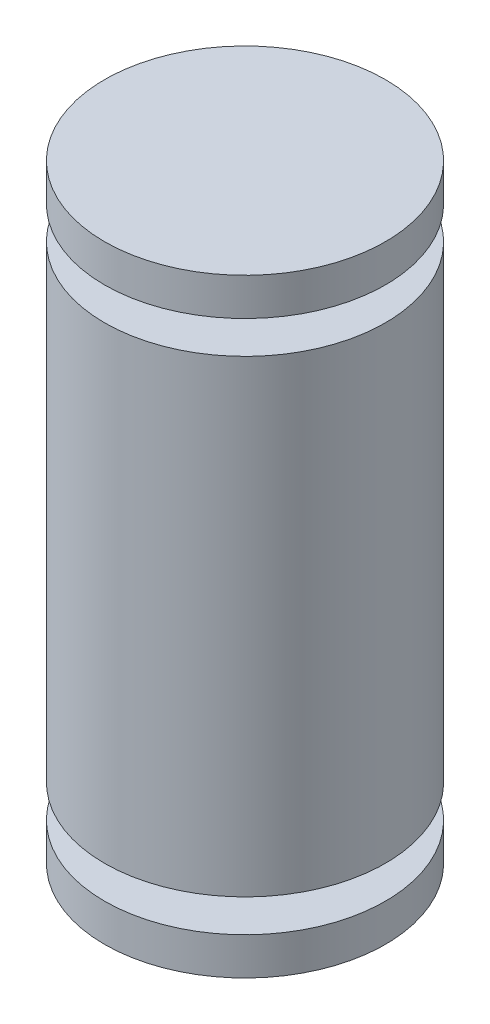
from build123d import *


with BuildPart() as part:
    # Sketch1 → Revolve1 (revolve)
    with BuildSketch(Plane.XY, mode=Mode.PRIVATE) as revolve1_sk:
        Polygon((0, 2.5), (0, 12.5), (-1, 12.5), (-1, 13.2), (0, 13.2), (0, 14), (-3, 14), (-3, 1), (0, 1), (0, 1.8), (-1, 1.8), (-1, 2.5), align=None)
    revolve(revolve1_sk.sketch.rotate(Axis((-3, 14, 0), (0, -1, 0)), 90), axis=Axis((-3, 14, 0), (0, -1, 0)))


solid = part.part
